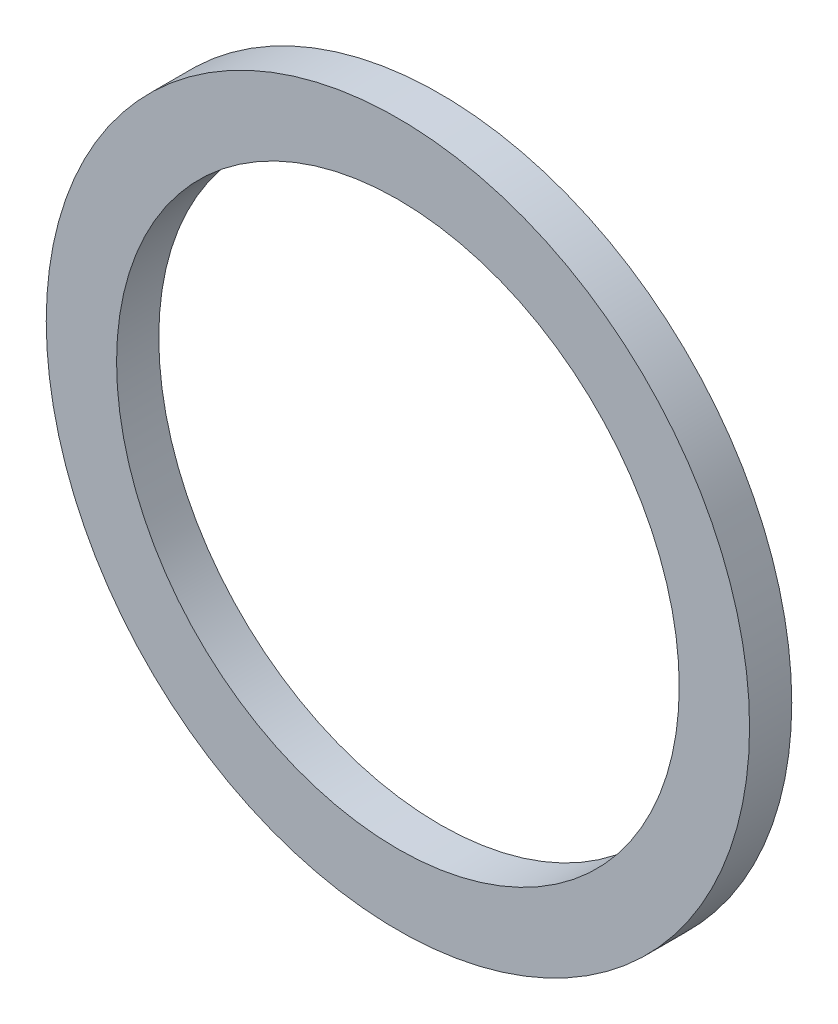
from build123d import *

# Parameters (mm, degrees)
SKETCH1_R           = 25
SKETCH1_R_2         = 20
BOSS_EXTRUDE1_DEPTH = 2
SKETCH2_R           = 25
BOSS_EXTRUDE2_DEPTH = 1
SKETCH3_R           = 20
CUT_EXTRUDE1_DEPTH  = 1


with BuildPart() as part:
    # Sketch1 → Boss-Extrude1 (new body)
    with BuildSketch(Plane.XY):
        Circle(SKETCH1_R)
        Circle(SKETCH1_R_2, mode=Mode.SUBTRACT)
    extrude(amount=BOSS_EXTRUDE1_DEPTH)

    # Sketch2 → Boss-Extrude2 (add)
    with BuildSketch(Plane.XY.offset(2)):
        Circle(SKETCH2_R)
    extrude(amount=BOSS_EXTRUDE2_DEPTH)

    # Sketch3 → Cut-Extrude1 (cut)
    with BuildSketch(Plane(origin=(0, 0, 2), x_dir=(-1, 0, 0), z_dir=(0, 0, -1))):
        Circle(SKETCH3_R)
    extrude(amount=-CUT_EXTRUDE1_DEPTH, mode=Mode.SUBTRACT)


solid = part.part
